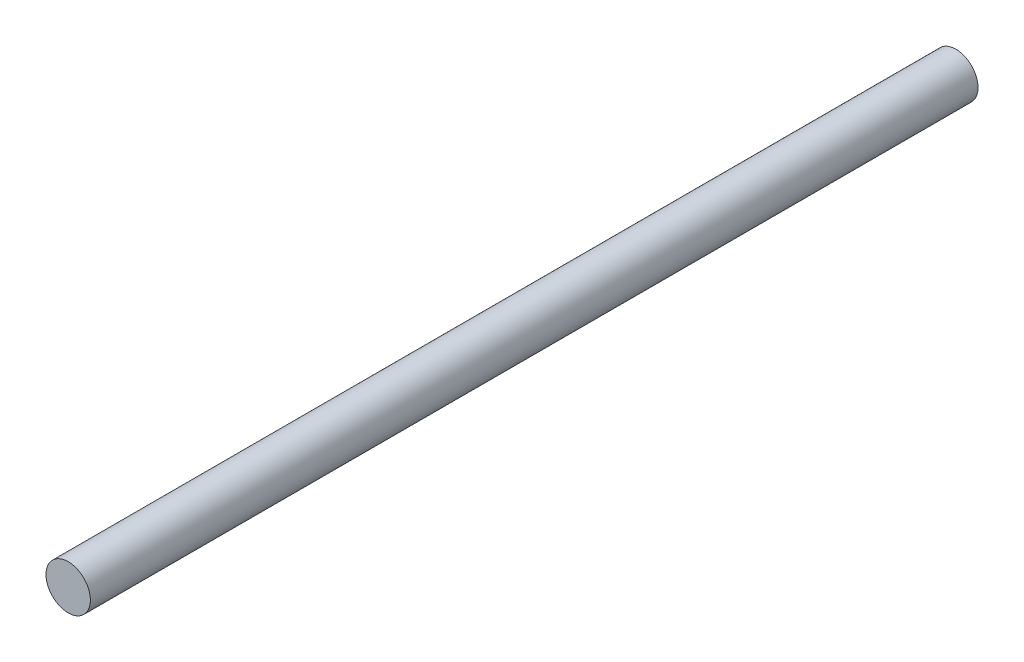
from build123d import *

# Parameters (mm, degrees)
SKETCH1_R           = 1.905
BOSS_EXTRUDE1_DEPTH = 76.2


with BuildPart() as part:
    # Sketch1 → Boss-Extrude1 (new body)
    with BuildSketch(Plane.XY):
        with Locations(Location((0, 0, 0), (0, 0, 180))):
            Circle(SKETCH1_R)
    extrude(amount=BOSS_EXTRUDE1_DEPTH)


solid = part.part
